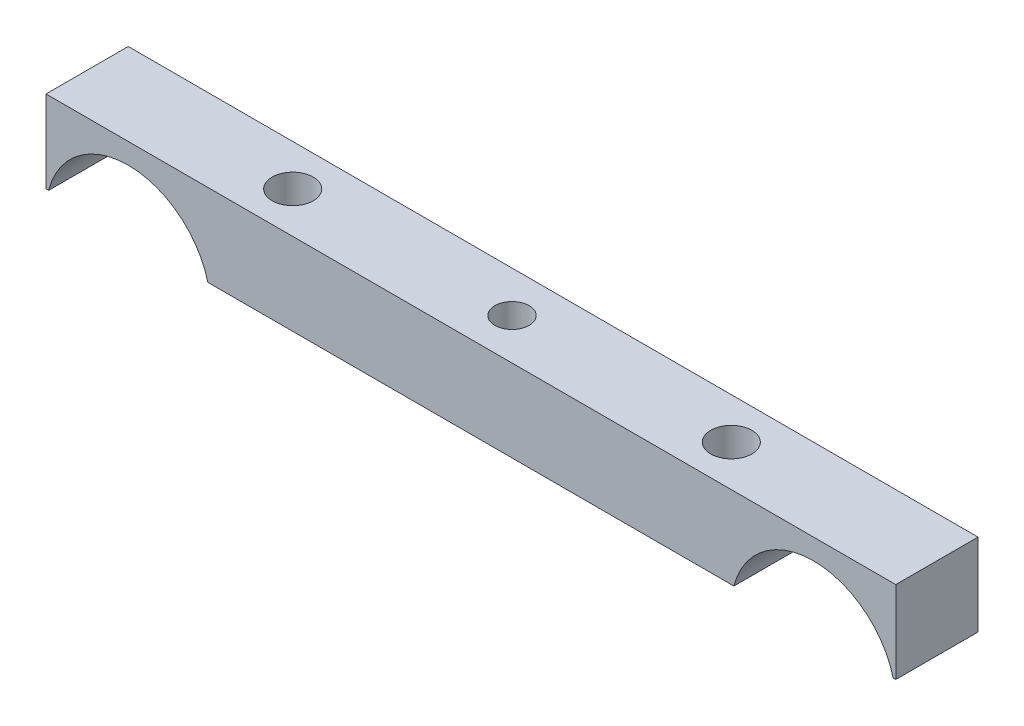
from build123d import *

# Parameters (mm, degrees)
BOSS_EXTRU_1_DEPTH      = 6
ESQUISSE2_R             = 1.5
ESQUISSE2_R_2           = 1.25
ENL_V_MAT_EXTRU_1_DEPTH = 6


with BuildPart() as part:
    # Esquisse1 → Boss.-Extru.1 (new body)
    with BuildSketch(Plane.XY):
        with BuildLine():
            Line((-31, 1.5), (-31, 7.5))
            Line((-31, 7.5), (31, 7.5))
            Line((31, 7.5), (31, 1.5))
            Line((31, 1.5), (30.809475019, 1.5))
            ThreePointArc((30.809475019, 1.5), (25, 6), (19.190524981, 1.5))
            Line((19.190524981, 1.5), (-19.190524981, 1.5))
            ThreePointArc((-19.190524981, 1.5), (-25, 6), (-30.809475019, 1.5))
            Line((-30.809475019, 1.5), (-31, 1.5))
        make_face()
    extrude(amount=BOSS_EXTRU_1_DEPTH)

    # Esquisse2 → Enlèv. mat.-Extru.1 (cut)
    with BuildSketch(Plane(origin=(0, 7.5, 0), x_dir=(1, 0, 0), z_dir=(0, 1, 0))):
        with Locations(Location((-16, -3, 0), (0, 0, 270))):
            Circle(ESQUISSE2_R)
        with Locations(Location((16, -3, 0), (0, 0, 270))):
            Circle(ESQUISSE2_R)
        with Locations(Location((0, -3, 0), (0, 0, 270))):
            Circle(ESQUISSE2_R_2)
    extrude(amount=-ENL_V_MAT_EXTRU_1_DEPTH, mode=Mode.SUBTRACT)


solid = part.part
